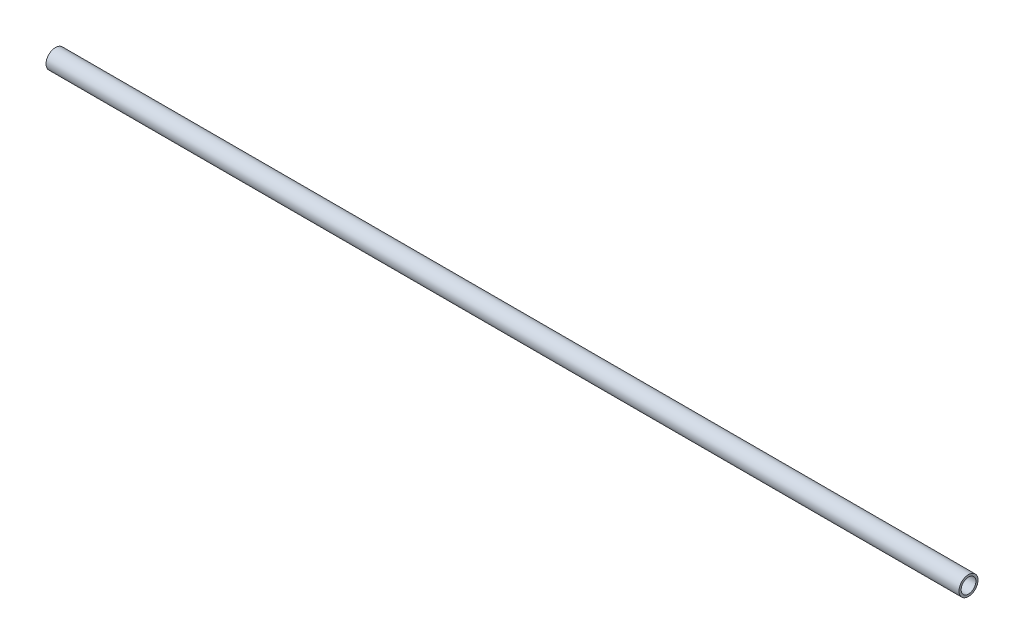
from build123d import *

# Parameters (mm, degrees)
SKETCH1_R      = 3.175
SKETCH1_R_2    = 2.4638
EXTRUDE1_DEPTH = 152.4


with BuildPart() as part:
    # Sketch1 → Extrude1 (new, symmetric)
    with BuildSketch(Plane(origin=(0, 0, 0), x_dir=(0, 0, -1), z_dir=(1, 0, 0))):
        with Locations(Location((0, 0, 0), (0, 0, 180))):
            Circle(SKETCH1_R)
        with Locations(Location((0, 0, 0), (0, 0, 180))):
            Circle(SKETCH1_R_2, mode=Mode.SUBTRACT)
    extrude(amount=EXTRUDE1_DEPTH, both=True)


solid = part.part
